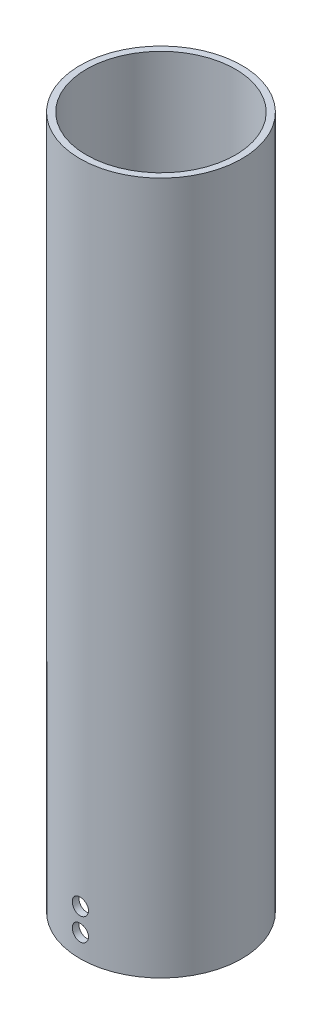
from build123d import *

# Parameters (mm, degrees)
SKETCH_1_R               = 25
SKETCH_1_R_2             = 23
EXTRUDE_1_DEPTH          = 214
CUT_EXTRUDE_1_DEPTH      = 217.90089903
CUT_EXTRUDE_1_DEPTH_BACK = 217.90089903
SKETCH_2_R               = 2.5


with BuildPart() as part:
    # Эскиз1 → Бобышка-Вытянуть1 (new body)
    with BuildSketch(Plane(origin=(0, 0, 0), x_dir=(1, 0, 0), z_dir=(0, 1, 0))):
        with Locations(Location((0, 0, 0), (0, 0, 270))):
            Circle(SKETCH_1_R)
        with Locations(Location((0, 0, 0), (0, 0, 270))):
            Circle(SKETCH_1_R_2, mode=Mode.SUBTRACT)
    extrude(amount=EXTRUDE_1_DEPTH)

    # Эскиз2 → Вырез-Вытянуть1 (cut, two sides: drawn at the far end of the back side and taken through both)
    with BuildSketch(Plane.XY.offset(-CUT_EXTRUDE_1_DEPTH_BACK)):
        with Locations((0, 7)):
            Circle(SKETCH_2_R)
        with Locations((0, 14)):
            Circle(SKETCH_2_R)
    extrude(amount=CUT_EXTRUDE_1_DEPTH + CUT_EXTRUDE_1_DEPTH_BACK, mode=Mode.SUBTRACT)


solid = part.part
